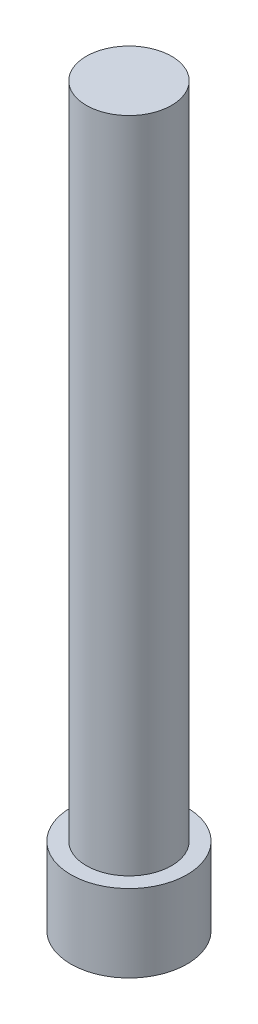
from build123d import *

# Parameters (mm, degrees)
SKETCH1_R           = 7.5
BOSS_EXTRUDE2_DEPTH = 10
SKETCH2_R           = 5.5
BOSS_EXTRUDE4_DEPTH = 85


with BuildPart() as part:
    # Sketch1 → Boss-Extrude2 (new body)
    with BuildSketch(Plane(origin=(0, 0, 0), x_dir=(1, 0, 0), z_dir=(0, 1, 0))):
        with Locations(Location((0, 0, 0), (0, 0, 270))):
            Circle(SKETCH1_R)
    extrude(amount=BOSS_EXTRUDE2_DEPTH)

    # Sketch2 → Boss-Extrude4 (add)
    with BuildSketch(Plane(origin=(0, 10, 0), x_dir=(1, 0, 0), z_dir=(0, 1, 0))):
        with Locations(Location((0, 0, 0), (0, 0, 270))):
            Circle(SKETCH2_R)
    extrude(amount=BOSS_EXTRUDE4_DEPTH)


solid = part.part
